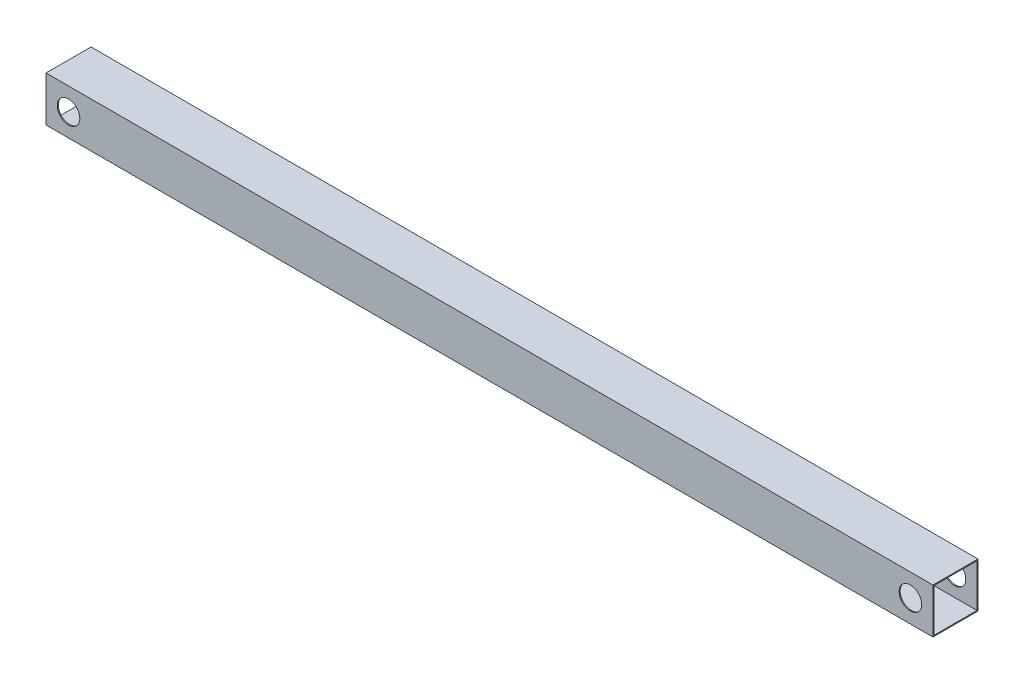
from build123d import *

# Parameters (mm, degrees)
SKETCH1_W                              = 25.4
SKETCH1_H                              = 25.4
SKETCH1_W_2                            = 24.2824
SKETCH1_H_2                            = 24.2824
AL_TUBE_SQUARE_1_SQ_X_022_WALL_3_DEPTH = 500
CROQUIS3_R                             = 6.35
CORTAR_EXTRUIR1_DEPTH                  = 501.805800685


with BuildPart() as part:
    # Sketch1 → Al tube (square) 1 SQ X .022 WALL(3) (new body)
    with BuildSketch(Plane.YZ):
        Rectangle(SKETCH1_W, SKETCH1_H)
        Rectangle(SKETCH1_W_2, SKETCH1_H_2, mode=Mode.SUBTRACT)
    extrude(amount=AL_TUBE_SQUARE_1_SQ_X_022_WALL_3_DEPTH)

    # Croquis3 → Cortar-Extruir1 (cut, through all)
    with BuildSketch(Plane.XY.offset(12.7)):
        with Locations((12.7, 0)):
            Circle(CROQUIS3_R)
        with Locations((487.3, 0)):
            Circle(CROQUIS3_R)
    extrude(amount=-CORTAR_EXTRUIR1_DEPTH, mode=Mode.SUBTRACT)


solid = part.part
